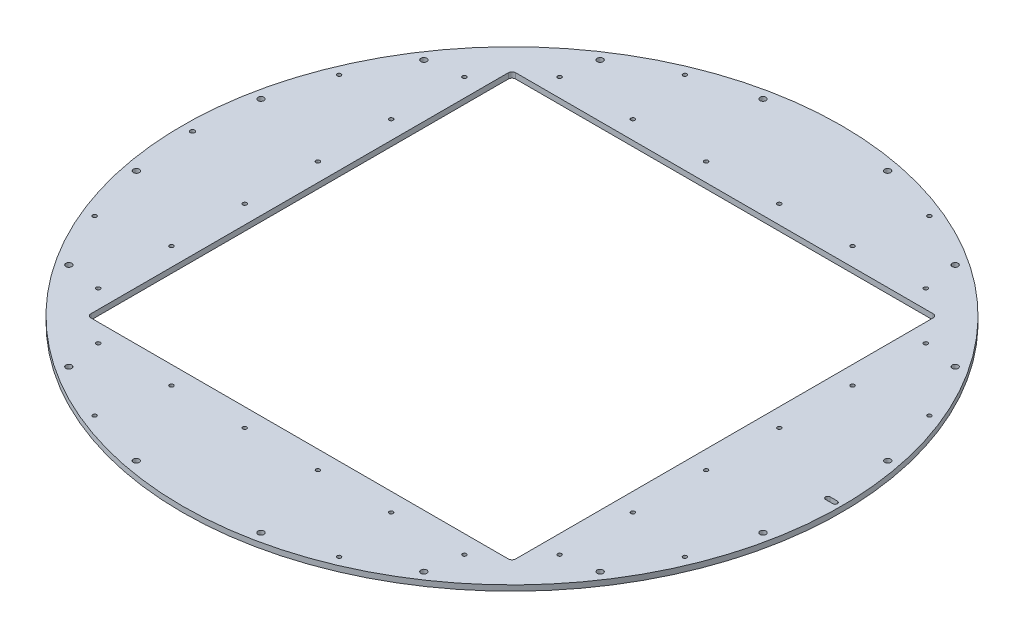
from build123d import *

# Parameters (mm, degrees)
SKETCH1_R                                        = 571.5
SKETCH1_W                                        = 736.6
SKETCH1_H                                        = 736.6
BOSS_EXTRUDE1_DEPTH                              = 9.525
SKETCH3_R                                        = 3.96875
CUT_EXTRUDE1_DEPTH                               = 809.279175548
F_3_8_CLEARANCE_HOLE1_D                          = 10.31748
CIRPATTERN_16X_3_8_CLEARANCE_HOLES_COUNT         = 16
F_1_4_BOX_HOLES_2_D                              = 6.7564
LPATTERN1_COUNT                                  = 6
LPATTERN1_PITCH                                  = 127
LPATTERN1_COUNT_DIR2                             = 2
LPATTERN1_PITCH_DIR2                             = 800.1
F_1_4_BOX_HOLES_1_D                              = 6.7564
LPATTERN2_COUNT                                  = 6
LPATTERN2_PITCH                                  = 127
LPATTERN2_COUNT_DIR2                             = 2
LPATTERN2_PITCH_DIR2                             = 800.1
CSK_FOR_1_4_FLAT_HEAD_MACHINE_SCREW1_D           = 6.7564
CSK_FOR_1_4_FLAT_HEAD_MACHINE_SCREW1_CSINK_D     = 12.8778
CSK_FOR_1_4_FLAT_HEAD_MACHINE_SCREW1_CSINK_ANGLE = 82
CIRPATTERN4_COUNT                                = 8
FILLET1_R                                        = 6.35


with BuildPart() as part:
    # Sketch1 → Boss-Extrude1 (new body)
    with BuildSketch(Plane(origin=(0, 0, 0), x_dir=(1, 0, 0), z_dir=(0, 1, 0))):
        with Locations(Location((0, 0, 0), (0, 0, 90))):
            Circle(SKETCH1_R)
        Rectangle(SKETCH1_W, SKETCH1_H, mode=Mode.SUBTRACT)
    extrude(amount=BOSS_EXTRUDE1_DEPTH)

    # Sketch3 → Cut-Extrude1 (cut, through all)
    with BuildSketch(Plane(origin=(0, 9.525, 0), x_dir=(1, 0, 0), z_dir=(0, 1, 0))):
        with Locations(Location((-554.0375, 0, 0), (0, 0, 270))):
            Circle(SKETCH3_R)
        with BuildLine():
            Line((547.6875, 3.96875), (560.3875, 3.96875))
            ThreePointArc((560.3875, 3.96875), (564.35625, 0), (560.3875, -3.96875))
            Line((560.3875, -3.96875), (547.6875, -3.96875))
            ThreePointArc((547.6875, -3.96875), (543.71875, 0), (547.6875, 3.96875))
        make_face()
    extrude(amount=-CUT_EXTRUDE1_DEPTH, mode=Mode.SUBTRACT)

    # 3/8 Clearance Hole1 (through all)
    with Locations(Plane(origin=(0, 0, 0), x_dir=(-1, 0, 0), z_dir=(0, -1, 0))):
        with Locations((-543.391824791, -108.087354284)):
            f_3_8_clearance_hole1 = Hole(F_3_8_CLEARANCE_HOLE1_D / 2)

    # CirPattern - 16X 3/8 Clearance Holes: 3/8 Clearance Hole1 ×16 about axis
    cirpattern_16x_3_8_clearance_holes_axis = Axis((0, 0, 0), (0, 1, 0))
    for i in range(1, CIRPATTERN_16X_3_8_CLEARANCE_HOLES_COUNT):
        add(f_3_8_clearance_hole1.rotate(cirpattern_16x_3_8_clearance_holes_axis, i * 360 / CIRPATTERN_16X_3_8_CLEARANCE_HOLES_COUNT), mode=Mode.SUBTRACT)

    # 1/4 Box Holes 2 (through all)
    with Locations(Plane(origin=(0, 9.525, 0), x_dir=(1, 0, 0), z_dir=(0, 1, 0))):
        with Locations((-317.5, -400.05)):
            f_1_4_box_holes_2 = Hole(F_1_4_BOX_HOLES_2_D / 2)

    # LPattern1: 1_4 Box Holes 2 6 × 2
    with Locations(*[(i * LPATTERN1_PITCH, 0, -j * LPATTERN1_PITCH_DIR2) for i in range(LPATTERN1_COUNT) for j in range(LPATTERN1_COUNT_DIR2) if (i, j) != (0, 0)]):
        add(f_1_4_box_holes_2, mode=Mode.SUBTRACT)

    # 1/4 Box Holes 1 (through all)
    with Locations(Plane(origin=(0, 9.525, 0), x_dir=(1, 0, 0), z_dir=(0, 1, 0))):
        with Locations((-400.05, -317.5)):
            f_1_4_box_holes_1 = Hole(F_1_4_BOX_HOLES_1_D / 2)

    # LPattern2: 1_4 Box Holes 1 6 × 2
    with Locations(*[(j * LPATTERN2_PITCH_DIR2, 0, -i * LPATTERN2_PITCH) for i in range(LPATTERN2_COUNT) for j in range(LPATTERN2_COUNT_DIR2) if (i, j) != (0, 0)]):
        add(f_1_4_box_holes_1, mode=Mode.SUBTRACT)

    # CSK for 1/4 Flat Head Machine Screw1 (through all)
    with Locations(Plane(origin=(0, 0, 0), x_dir=(-1, 0, 0), z_dir=(0, -1, 0))):
        with Locations((-511.863906494, 212.020972159)):
            csk_for_1_4_flat_head_machine_screw1 = CounterSinkHole(CSK_FOR_1_4_FLAT_HEAD_MACHINE_SCREW1_D / 2, CSK_FOR_1_4_FLAT_HEAD_MACHINE_SCREW1_CSINK_D / 2, counter_sink_angle=CSK_FOR_1_4_FLAT_HEAD_MACHINE_SCREW1_CSINK_ANGLE)

    # CirPattern4: CSK for 1/4 Flat Head Machine Screw1 ×8 about axis
    cirpattern4_axis = Axis((0, 0, 0), (0, 1, 0))
    for i in range(1, CIRPATTERN4_COUNT):
        add(csk_for_1_4_flat_head_machine_screw1.rotate(cirpattern4_axis, i * 360 / CIRPATTERN4_COUNT), mode=Mode.SUBTRACT)

    # Fillet1
    fillet1_edges = [part.edges().sort_by_distance(p)[0] for p in [
        (-368.3, 4.7625, -368.3),
        (-368.3, 4.7625, 368.3),
        (368.3, 4.7625, 368.3),
        (368.3, 4.7625, -368.3),
    ]]
    fillet(fillet1_edges, radius=FILLET1_R)


solid = part.part
